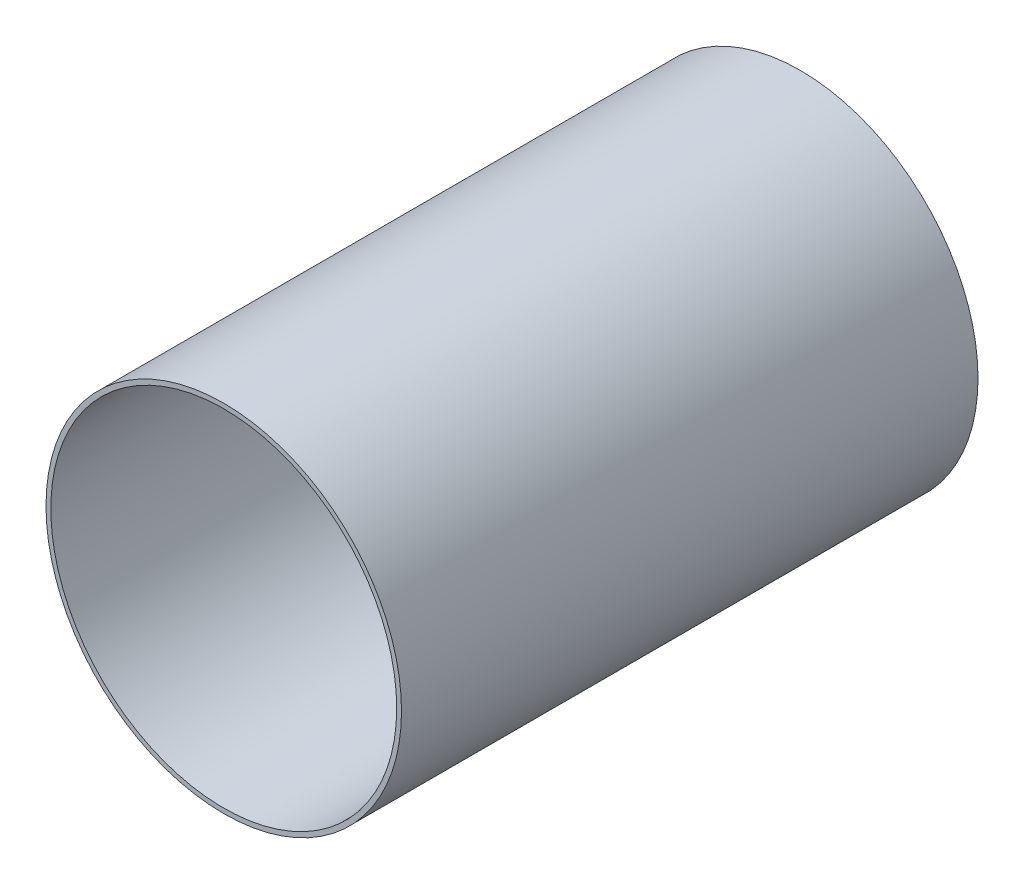
from build123d import *

# Parameters (mm, degrees)
SKETCH_1_R      = 92.5
SKETCH_1_R_2    = 90
EXTRUDE_1_DEPTH = 300


with BuildPart() as part:
    # 草图1 → 凸台-拉伸1 (new body)
    with BuildSketch(Plane.XY):
        Circle(SKETCH_1_R)
        Circle(SKETCH_1_R_2, mode=Mode.SUBTRACT)
    extrude(amount=EXTRUDE_1_DEPTH)


solid = part.part
